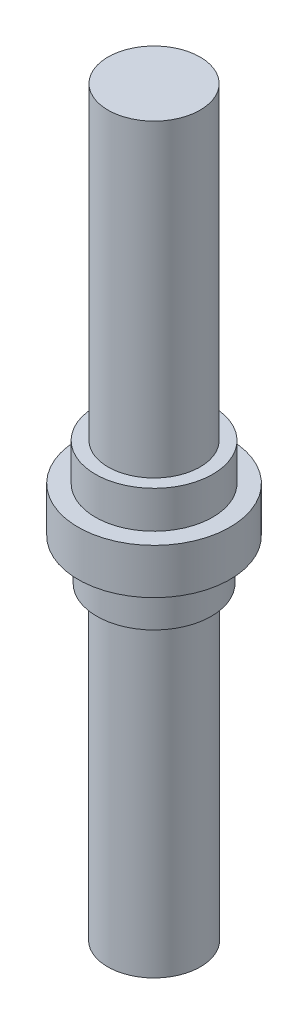
from build123d import *

# Parameters (mm, degrees)
SKETCH_2_W   = 1.5
SKETCH_2_H   = 10
SKETCH_2_W_2 = 1.489718874


with BuildPart() as part:
    # 草图2 → 旋转1 (revolve)
    with BuildSketch(Plane(origin=(0, 0, 0), x_dir=(0, 0, -1), z_dir=(1, 0, 0))):
        with Locations((0.75, 5)):
            Rectangle(SKETCH_2_W, SKETCH_2_H)
        Polygon((0, 11.333239566), (0, 10), (1.5, 10), (1.852020266, 10), (1.852020266, 11.333239566), align=None)
        Polygon((0, 12.799080051), (0, 11.333239566), (1.852020266, 11.333239566), (2.456922178, 11.333239566), (2.456922178, 12.799080051), (1.898093602, 12.799080051), align=None)
        Polygon((0, 14.00271083), (0, 12.799080051), (1.898093602, 12.799080051), (1.898093602, 14.00271083), (1.489718874, 14.00271083), align=None)
        with Locations((0.744859437, 19.00271083)):
            Rectangle(SKETCH_2_W_2, SKETCH_2_H)
    revolve(axis=Axis((0, 0, 0), (0, 1, 0)))


solid = part.part
